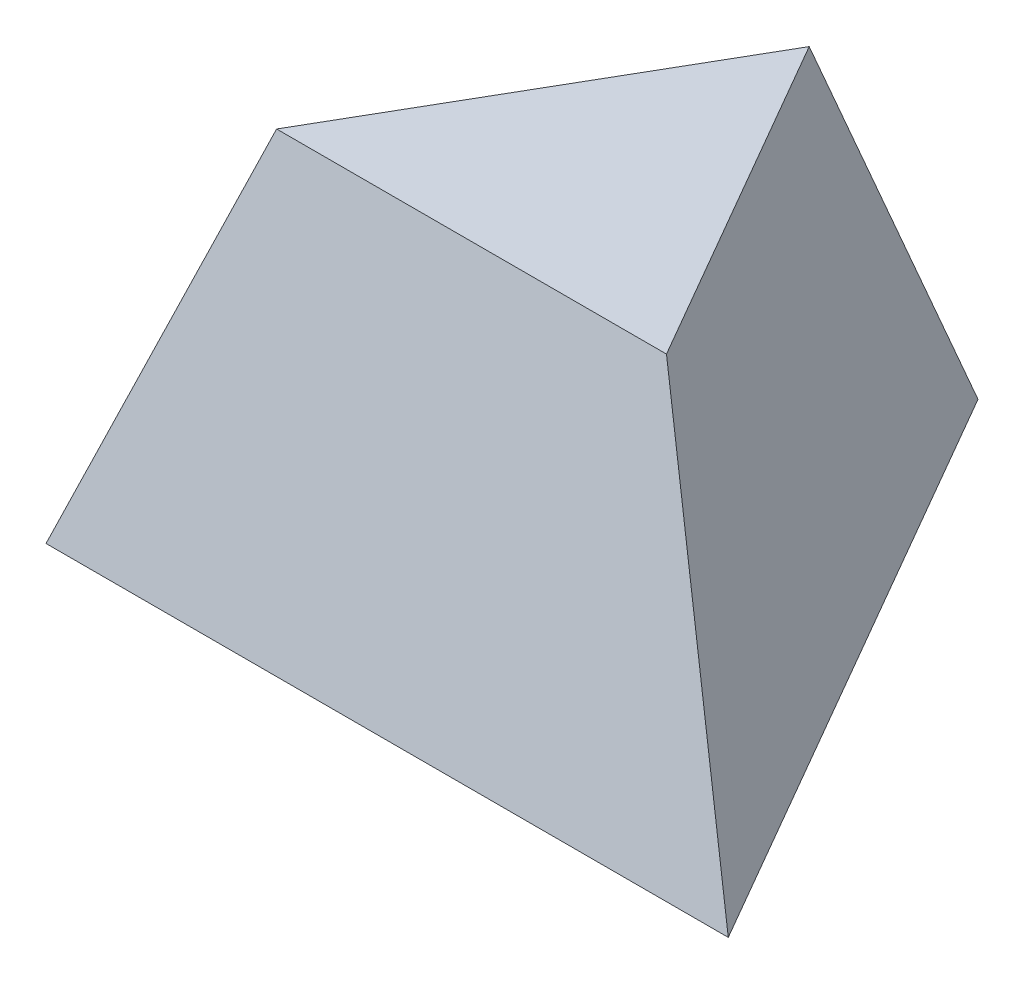
from build123d import *

# Parameters (mm, degrees)
BOSS_EXTRUDE1_DEPTH = 101.6
SKETCH3_W           = 415.71343084
SKETCH3_H           = 232.25163297
CUT_EXTRUDE1_DEPTH  = 152.4
SKETCH4_W           = 330.261627224
SKETCH4_H           = 257.519114475
CUT_EXTRUDE2_DEPTH  = 152.4
SKETCH5_W           = 304.13342749
SKETCH5_H           = 210.120003228
CUT_EXTRUDE3_DEPTH  = 152.4


with BuildPart() as part:
    # Sketch1 → Boss-Extrude1 (new body)
    with BuildSketch(Plane(origin=(0, 0, 0), x_dir=(1, 0, 0), z_dir=(0, 1, 0))):
        Polygon((0, 102.652877862), (-88.9, -51.326438931), (88.9, -51.326438931), align=None)
    extrude(amount=BOSS_EXTRUDE1_DEPTH)

    # Sketch3 → Cut-Extrude1 (cut)
    with BuildSketch(Plane(origin=(-42.459701493, 10.614925373, -24.514120086), x_dir=(0.4832445480711858, -0.0803381317273392, -0.8717915412241828), z_dir=(0.846414739030318, -0.2116036847575797, 0.4886777774252209))):
        with Locations((15.518535429, 25.810339784)):
            Rectangle(SKETCH3_W, SKETCH3_H)
    extrude(amount=-CUT_EXTRUDE1_DEPTH, mode=Mode.SUBTRACT)

    # Sketch4 → Cut-Extrude2 (cut)
    with BuildSketch(Plane(origin=(0, 10.614925373, 49.028240173), x_dir=(-1, 0, 0), z_dir=(0, -0.2116036847575795, -0.9773555548504419))):
        with Locations((6.792319927, 42.566259276)):
            Rectangle(SKETCH4_W, SKETCH4_H)
    extrude(amount=-CUT_EXTRUDE2_DEPTH, mode=Mode.SUBTRACT)

    # Sketch5 → Cut-Extrude3 (cut)
    with BuildSketch(Plane(origin=(42.459701493, 10.614925373, -24.514120086), x_dir=(0.4832445480711859, 0.08033813172733906, 0.8717915412241828), z_dir=(-0.8464147390303179, -0.21160368475757932, 0.4886777774252209))):
        with Locations((15.433156883, 49.391097897)):
            Rectangle(SKETCH5_W, SKETCH5_H)
    extrude(amount=-CUT_EXTRUDE3_DEPTH, mode=Mode.SUBTRACT)


solid = part.part
